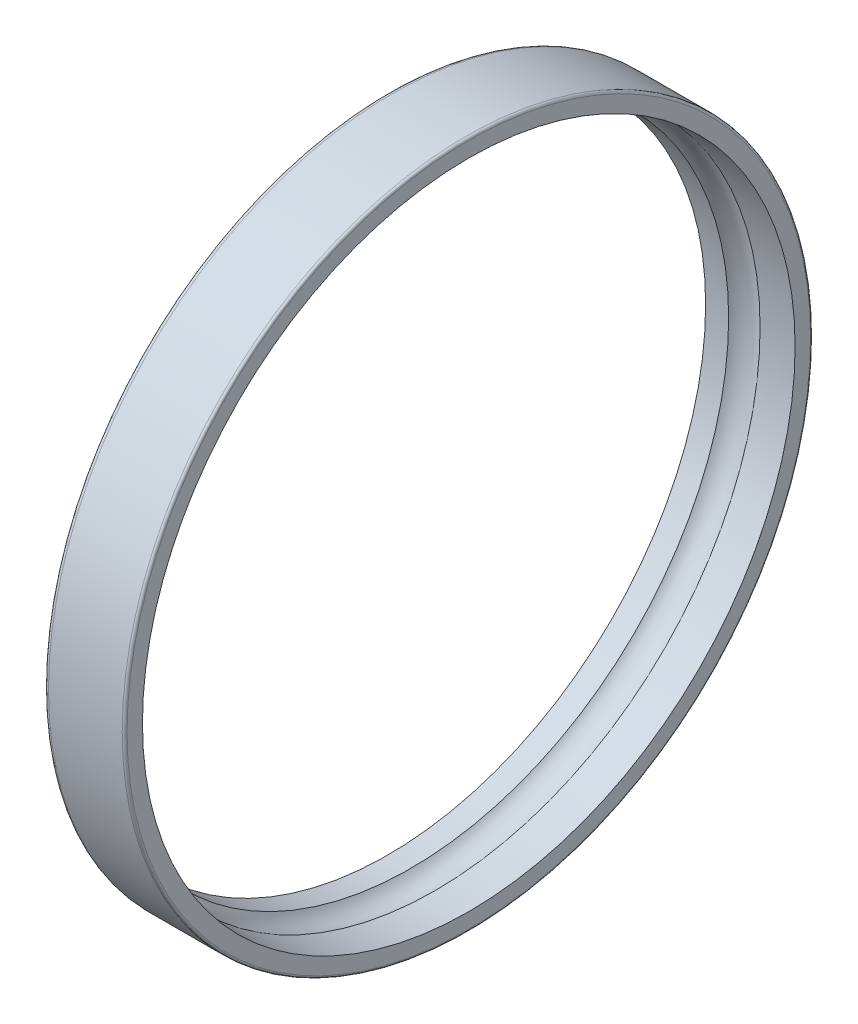
from build123d import *


with BuildPart() as part:
    # 草图1 → 旋转1 (revolve)
    with BuildSketch(Plane.XY, mode=Mode.PRIVATE) as revolve_1_sk:
        with BuildLine():
            Line((9.7, 42.5), (0.6, 42.5))
            ThreePointArc((0.6, 42.5), (0.175735931, 42.324264069), (0, 41.9))
            Line((0, 41.9), (0, 39.25))
            Line((0, 39.25), (2.842505156, 39.25))
            ThreePointArc((2.842505156, 39.25), (4.193041023, 40.158213914), (5.820549028, 40.154050356))
            Line((5.820549028, 40.154050356), (10, 40.3))
            Line((10, 40.3), (10, 42.2))
            ThreePointArc((10, 42.2), (9.912132034, 42.412132034), (9.7, 42.5))
        make_face()
    revolve(revolve_1_sk.sketch.rotate(Axis((-0.001270488, 0, 0), (1, 0, 0)), 270), axis=Axis((-0.001270488, 0, 0), (1, 0, 0)))


solid = part.part
